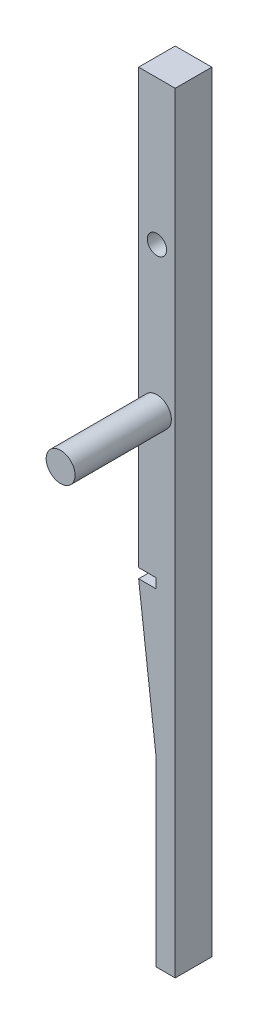
from build123d import *

# Parameters (mm, degrees)
ESBO_O1_W                = 3.8
ESBO_O1_H                = 45
RESSALTO_EXTRUS_O1_DEPTH = 3.8
ESBO_O2_R                = 1.5
RESSALTO_EXTRUS_O2_DEPTH = 10
ESBO_O3_W                = 2
ESBO_O3_H                = 3.8
RESSALTO_EXTRUS_O3_DEPTH = 1
ESBO_O5_R                = 1
CORTE_EXTRUS_O1_DEPTH    = 4
RESSALTO_EXTRUS_O7_DEPTH = 3.8
ESBO_O10_W               = 2
ESBO_O10_H               = 3.8
RESSALTO_EXTRUS_O8_DEPTH = 19


with BuildPart() as part:
    # Esboço1 → Ressalto-extrusão1 (new body)
    with BuildSketch(Plane.XY):
        with Locations((-14.624350205, 5.125)):
            Rectangle(ESBO_O1_W, ESBO_O1_H)
    extrude(amount=RESSALTO_EXTRUS_O1_DEPTH)

    # Esboço2 → Ressalto-extrusão2 (add)
    with BuildSketch(Plane.XY.offset(3.8)):
        with Locations((-14.624350205, -2.375)):
            Circle(ESBO_O2_R)
    extrude(amount=RESSALTO_EXTRUS_O2_DEPTH)

    # Esboço3 → Ressalto-extrusão3 (add)
    with BuildSketch(Plane(origin=(0, -17.375, 0), x_dir=(-1, 0, 0), z_dir=(0, -1, 0))):
        with Locations((13.724350205, -1.9)):
            Rectangle(ESBO_O3_W, ESBO_O3_H)
    extrude(amount=RESSALTO_EXTRUS_O3_DEPTH)

    # Esboço5 → Corte-extrusão1 (cut)
    with BuildSketch(Plane.XY.offset(3.8)):
        with Locations((-14.624350205, 12.625)):
            Circle(ESBO_O5_R)
    extrude(amount=-CORTE_EXTRUS_O1_DEPTH, mode=Mode.SUBTRACT)

    # Esboço9 → Ressalto-extrusão7 (add)
    with BuildSketch(Plane.XY.offset(3.8)):
        Polygon((-12.724350205, -18.375), (-12.724350205, -33.375), (-14.724350205, -33.375), (-16.524350205, -18.375), align=None)
    extrude(amount=-RESSALTO_EXTRUS_O7_DEPTH)

    # Esboço10 → Ressalto-extrusão8 (add)
    with BuildSketch(Plane(origin=(0, -33.375, 0), x_dir=(-1, 0, 0), z_dir=(0, -1, 0))):
        with Locations((13.724350205, -1.9)):
            Rectangle(ESBO_O10_W, ESBO_O10_H)
    extrude(amount=RESSALTO_EXTRUS_O8_DEPTH)


solid = part.part
